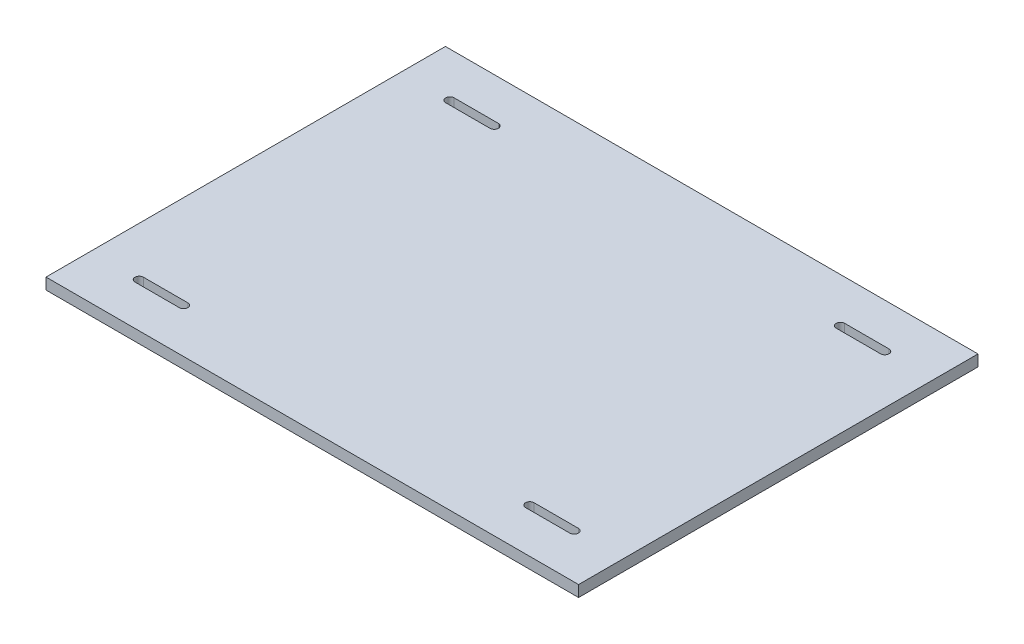
from build123d import *

# Parameters (mm, degrees)
CROQUIS1_W              = 1200
CROQUIS1_H              = 900
SALIENTE_EXTRUIR1_DEPTH = 25.4
CORTAR_EXTRUIR1_DEPTH   = 25.4


with BuildPart() as part:
    # Croquis1 → Saliente-Extruir1 (new body)
    with BuildSketch(Plane(origin=(0, 0, 0), x_dir=(1, 0, 0), z_dir=(0, 1, 0))):
        Rectangle(CROQUIS1_W, CROQUIS1_H)
    extrude(amount=SALIENTE_EXTRUIR1_DEPTH)

    # Croquis2 → Cortar-Extruir1 (cut)
    with BuildSketch(Plane(origin=(0, 25.4, 0), x_dir=(1, 0, 0), z_dir=(0, 1, 0))):
        with BuildLine():
            Line((390, 359.525), (490, 359.525))
            ThreePointArc((490, 359.525), (499.525, 350), (490, 340.475))
            Line((490, 340.475), (390, 340.475))
            ThreePointArc((390, 340.475), (380.475, 350), (390, 359.525))
        make_face()
        with BuildLine():
            Line((-390, 340.475), (-490, 340.475))
            ThreePointArc((-490, 340.475), (-499.525, 350), (-490, 359.525))
            Line((-490, 359.525), (-390, 359.525))
            ThreePointArc((-390, 359.525), (-380.475, 350), (-390, 340.475))
        make_face()
        with BuildLine():
            Line((-390, -359.525), (-490, -359.525))
            ThreePointArc((-490, -359.525), (-499.525, -350), (-490, -340.475))
            Line((-490, -340.475), (-390, -340.475))
            ThreePointArc((-390, -340.475), (-380.475, -350), (-390, -359.525))
        make_face()
        with BuildLine():
            Line((390, -340.475), (490, -340.475))
            ThreePointArc((490, -340.475), (499.525, -350), (490, -359.525))
            Line((490, -359.525), (390, -359.525))
            ThreePointArc((390, -359.525), (380.475, -350), (390, -340.475))
        make_face()
    extrude(amount=-CORTAR_EXTRUIR1_DEPTH, mode=Mode.SUBTRACT)


solid = part.part
